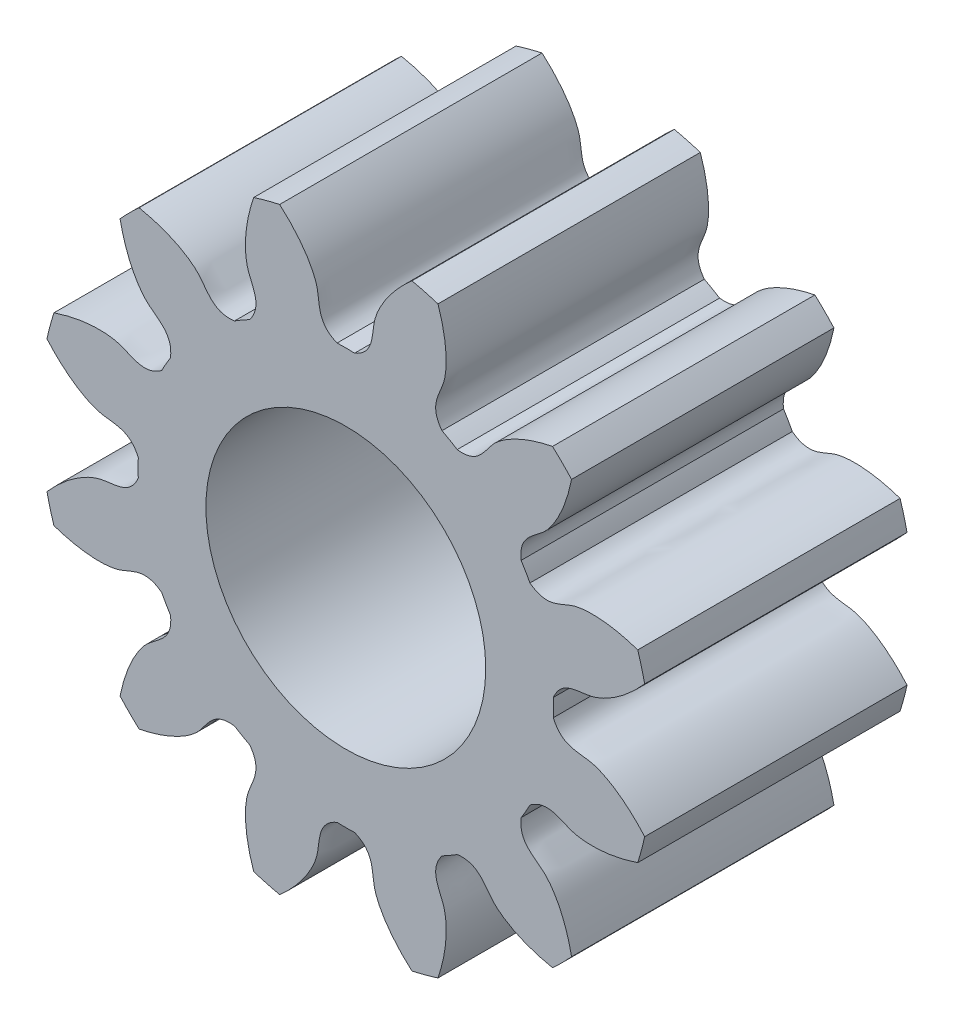
from build123d import *

# Parameters (mm, degrees)
SKETCH_1_R               = 3.5
EXTRUDE_1_DEPTH          = 3
CUT_EXTRUDE_1_DEPTH      = 6.787918451
PATTERN_CIRCULAR_1_COUNT = 12
CUT_EXTRUDE_2_REACH      = 7.688
SKETCH_5_R               = 1.6


with BuildPart() as part:
    # 草图1 → 凸台-拉伸1 (new body)
    with BuildSketch(Plane.XY):
        Circle(SKETCH_1_R)
    extrude(amount=EXTRUDE_1_DEPTH)

    # 草图2 → 切除-拉伸1 (cut, through all)
    with BuildSketch(Plane.XY):
        with BuildLine():
            ThreePointArc((0.100420056, 2.372876063), (0, 2.375), (-0.100420056, 2.372876063))
            add(Edge.make_bspline(
                [(-0.100420056, 2.372876063), (-0.340394435, 2.474653731), (-0.287186739, 2.672409341), (-0.338076094, 2.844740289), (-0.341311927, 2.854952869), (-0.345113625, 2.866166713), (-0.349521434, 2.878363044), (-0.354576313, 2.891521619), (-0.360318258, 2.905621034), (-0.36678678, 2.920638648), (-0.374020716, 2.936550626), (-0.382058239, 2.95333195), (-0.390936819, 2.970956436), (-0.400693193, 2.989396753), (-0.411363332, 3.008624444), (-0.422982412, 3.02860994), (-0.435584786, 3.049322589), (-0.449203949, 3.07073067), (-0.463872517, 3.092801417), (-0.479622192, 3.115501045), (-0.496483738, 3.138794769), (-0.514486952, 3.162646832), (-0.533660639, 3.187020528), (-0.554032585, 3.211878226), (-0.575629533, 3.237181399), (-0.598477155, 3.262890651), (-0.622600033, 3.288965742), (-0.648021632, 3.315365616), (-0.674764279, 3.342048434), (-0.702849139, 3.368971597), (-0.732296196, 3.396091781), (-0.763124233, 3.423364967), (-0.795350811, 3.450746465), (-0.828992247, 3.478190957), (-0.864063604, 3.505652518), (-0.900578664, 3.533084654), (-0.938549918, 3.560440334), (-0.977988547, 3.587672024), (-1.01890441, 3.614731718), (-1.061306025, 3.641570973), (-1.10520056, 3.668140947), (-1.150593819, 3.694392428), (-1.197490231, 3.720275872), (-1.245892835, 3.74574144), (-1.295803277, 3.770739031), (-1.347221796, 3.79521832), (-1.400147219, 3.819128792), (-1.454576948, 3.842419781), (-1.510506963, 3.865040505), (-1.567931802, 3.886940103), (-1.647189853, 3.915363979), (-1.7077968, 3.935050704), (-1.748802701, 3.947485455)],
                knots=[0, 0, 0, 0, 0.218015236, 0.222043642, 0.226545979, 0.231522246, 0.236972443, 0.24289657, 0.249294627, 0.256166614, 0.263512532, 0.271332379, 0.279626157, 0.288393865, 0.297635503, 0.307351072, 0.31754057, 0.328203999, 0.339341357, 0.350952646, 0.363037866, 0.375597015, 0.388630094, 0.402137104, 0.416118043, 0.430572913, 0.445501713, 0.460904444, 0.476781104, 0.493131694, 0.509956215, 0.527254666, 0.545027047, 0.563273358, 0.581993599, 0.601187771, 0.620855872, 0.640997904, 0.661613866, 0.682703758, 0.704267581, 0.726305333, 0.748817015, 0.771802628, 0.795262171, 0.819195644, 0.843603047, 0.868484381, 0.893839644, 0.919668838, 0.945971962, 1, 1, 1, 1], degree=3))
            ThreePointArc((-1.748802701, 3.947485455), (0, 4.317516914), (1.748802701, 3.947485455))
            add(Edge.make_bspline(
                [(0.100420056, 2.372876063), (0.340394435, 2.474653731), (0.287186739, 2.672409341), (0.338076094, 2.844740289), (0.341311927, 2.854952869), (0.345113625, 2.866166713), (0.349521434, 2.878363044), (0.354576313, 2.891521619), (0.360318258, 2.905621034), (0.36678678, 2.920638648), (0.374020716, 2.936550626), (0.382058239, 2.95333195), (0.390936819, 2.970956436), (0.400693193, 2.989396753), (0.411363332, 3.008624444), (0.422982412, 3.02860994), (0.435584786, 3.049322589), (0.449203949, 3.07073067), (0.463872517, 3.092801417), (0.479622192, 3.115501045), (0.496483738, 3.138794769), (0.514486952, 3.162646832), (0.533660639, 3.187020528), (0.554032585, 3.211878226), (0.575629533, 3.237181399), (0.598477155, 3.262890651), (0.622600033, 3.288965742), (0.648021632, 3.315365616), (0.674764279, 3.342048434), (0.702849139, 3.368971597), (0.732296196, 3.396091781), (0.763124233, 3.423364967), (0.795350811, 3.450746465), (0.828992247, 3.478190957), (0.864063604, 3.505652518), (0.900578664, 3.533084654), (0.938549918, 3.560440334), (0.977988547, 3.587672024), (1.01890441, 3.614731718), (1.061306025, 3.641570973), (1.10520056, 3.668140947), (1.150593819, 3.694392428), (1.197490231, 3.720275872), (1.245892835, 3.74574144), (1.295803277, 3.770739031), (1.347221796, 3.79521832), (1.400147219, 3.819128792), (1.454576948, 3.842419781), (1.510506963, 3.865040505), (1.567931802, 3.886940103), (1.647189853, 3.915363979), (1.7077968, 3.935050704), (1.748802701, 3.947485455)],
                knots=[0, 0, 0, 0, 0.218015236, 0.222043642, 0.226545979, 0.231522246, 0.236972443, 0.24289657, 0.249294627, 0.256166614, 0.263512532, 0.271332379, 0.279626157, 0.288393865, 0.297635503, 0.307351072, 0.31754057, 0.328203999, 0.339341357, 0.350952646, 0.363037866, 0.375597015, 0.388630094, 0.402137104, 0.416118043, 0.430572913, 0.445501713, 0.460904444, 0.476781104, 0.493131694, 0.509956215, 0.527254666, 0.545027047, 0.563273358, 0.581993599, 0.601187771, 0.620855872, 0.640997904, 0.661613866, 0.682703758, 0.704267581, 0.726305333, 0.748817015, 0.771802628, 0.795262171, 0.819195644, 0.843603047, 0.868484381, 0.893839644, 0.919668838, 0.945971962, 1, 1, 1, 1], degree=3))
        make_face()
    cut_extrude_1 = extrude(amount=CUT_EXTRUDE_1_DEPTH, mode=Mode.SUBTRACT)

    # 阵列(圆周)1: 切除-拉伸1 ×12 about axis
    pattern_circular_1_axis = Axis((0, 0, 3), (0, 0, -1))
    for i in range(1, PATTERN_CIRCULAR_1_COUNT):
        add(cut_extrude_1.rotate(pattern_circular_1_axis, i * 360 / PATTERN_CIRCULAR_1_COUNT), mode=Mode.SUBTRACT)

    # 草图5 → 切除-拉伸2 (cut, up to next)
    with BuildSketch(Plane.XY.offset(3), mode=Mode.PRIVATE) as cut_extrude_2_sk1:
        Circle(SKETCH_5_R)
    cut_extrude_2_tool1 = extrude(cut_extrude_2_sk1.sketch, amount=-CUT_EXTRUDE_2_REACH, mode=Mode.PRIVATE) & part.part
    add(cut_extrude_2_tool1.solids().sort_by_distance((0, 0, 3))[0], mode=Mode.SUBTRACT)


solid = part.part
